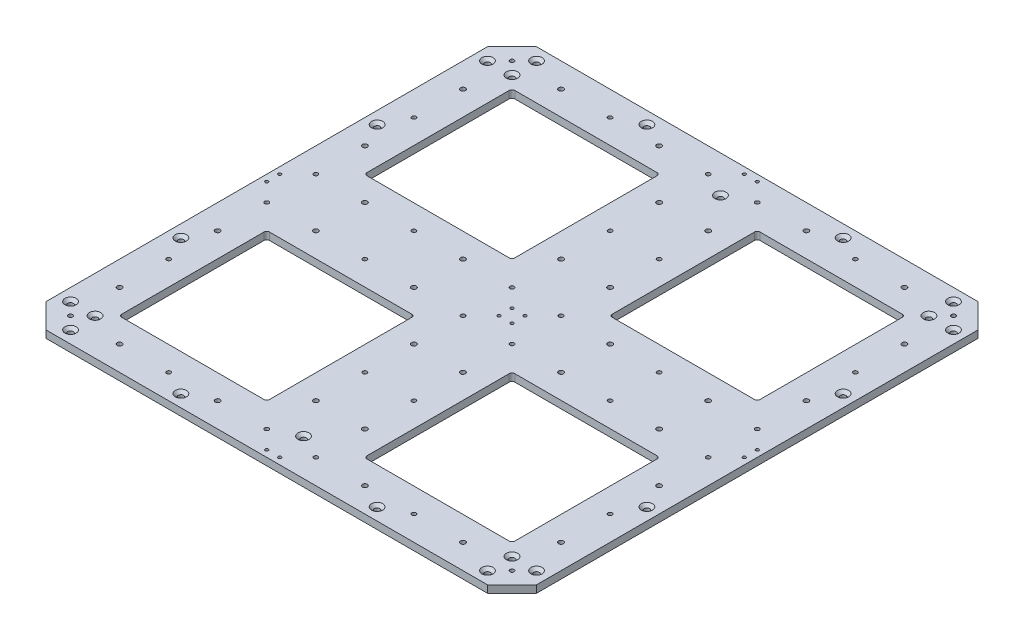
from build123d import *

# Parameters (mm, degrees)
SKETCH1_W                                            = 241
SKETCH1_H                                            = 241
BOSS_EXTRUDE1_DEPTH                                  = 12
M8_TAPPED_HOLE1_D                                    = 6.8
F_8_0MM_DOWEL_HOLE1_D                                = 8
LPATTERN1_COUNT                                      = 2
LPATTERN1_PITCH                                      = 400
LPATTERN1_COUNT_DIR2                                 = 2
LPATTERN1_PITCH_DIR2                                 = 400
CSK_FOR_M8_HEX_SOCKET_COUNTERSUNK_HEAD_S_D           = 9
CSK_FOR_M8_HEX_SOCKET_COUNTERSUNK_HEAD_S_CSINK_D     = 18.25
CSK_FOR_M8_HEX_SOCKET_COUNTERSUNK_HEAD_S_CSINK_ANGLE = 90
FILLET1_R                                            = 4.5
M6_TAPPED_HOLE1_D                                    = 5
CIRPATTERN1_COUNT                                    = 4


with BuildPart() as part:
    # Sketch1 → Boss-Extrude1 (new body)
    with BuildSketch(Plane(origin=(0, 0, 0), x_dir=(1, 0, 0), z_dir=(0, 1, 0))):
        Polygon((-400, 360), (-400, -360), (-360, -400), (360, -400), (400, -360), (400, 360), (360, 400), (-360, 400), align=None)
        with Locations((-200, -200)):
            Rectangle(SKETCH1_W, SKETCH1_H, mode=Mode.SUBTRACT)
        with Locations((200, 200)):
            Rectangle(SKETCH1_W, SKETCH1_H, mode=Mode.SUBTRACT)
        with Locations((200, -200)):
            Rectangle(SKETCH1_W, SKETCH1_H, mode=Mode.SUBTRACT)
        with Locations((-200, 200)):
            Rectangle(SKETCH1_W, SKETCH1_H, mode=Mode.SUBTRACT)
    extrude(amount=BOSS_EXTRUDE1_DEPTH)

    # M8 Tapped Hole1 (through all)
    with Locations(Plane(origin=(0, 12, 0), x_dir=(1, 0, 0), z_dir=(0, 1, 0))):
        with Locations((-360, 360), (360, 360), (-40, 360), (40, 360), (-40, 40), (40, 40), (360, 40), (-360, 40), (-360, -40), (-360, -360), (-40, -40), (-40, -360), (40, -360), (360, -360), (360, -40), (40, -40), (-200, 360), (200, 360), (360, 200), (200, 40), (40, 200), (-40, 200), (-200, 40), (-360, 200), (-200, -40), (-360, -200), (-200, -360), (-40, -200), (40, -200), (200, -40), (360, -200), (200, -360)):
            Hole(M8_TAPPED_HOLE1_D / 2)

    # Ø8.0mm Dowel Hole1 (through all)
    with Locations(Plane(origin=(0, 12, 0), x_dir=(1, 0, 0), z_dir=(0, 1, 0))):
        with Locations((-280, 360), (-120, 360), (-40, 280), (-40, 120), (-120, 40), (-280, 40), (-360, 120), (-360, 280)):
            f_8_0mm_dowel_hole1 = Hole(F_8_0MM_DOWEL_HOLE1_D / 2)

    # LPattern1: 8.0mm Dowel Hole1 2 × 2
    with Locations(*[(i * LPATTERN1_PITCH, 0, j * LPATTERN1_PITCH_DIR2) for i in range(LPATTERN1_COUNT) for j in range(LPATTERN1_COUNT_DIR2) if (i, j) != (0, 0)]):
        add(f_8_0mm_dowel_hole1, mode=Mode.SUBTRACT)

    # CSK for M8 Hex Socket Countersunk Head Screw1 (through all)
    with Locations(Plane(origin=(0, 12, 0), x_dir=(1, 0, 0), z_dir=(0, 1, 0))):
        with Locations((-380, 340), (-340, 380), (-380, -340), (380, -340), (380, 340), (-340, -380), (340, -380), (340, 380), (340, 340), (340, -340), (-340, -340), (0, -340), (0, 340), (-340, 340), (-160, 380), (160, 380), (380, 160), (380, -160), (160, -380), (-160, -380), (-380, -160), (-380, 160)):
            CounterSinkHole(CSK_FOR_M8_HEX_SOCKET_COUNTERSUNK_HEAD_S_D / 2, CSK_FOR_M8_HEX_SOCKET_COUNTERSUNK_HEAD_S_CSINK_D / 2, counter_sink_angle=CSK_FOR_M8_HEX_SOCKET_COUNTERSUNK_HEAD_S_CSINK_ANGLE)

    # Fillet1
    fillet1_edges = [part.edges().sort_by_distance(p)[0] for p in [
        (320.5, 6, -320.5),
        (-79.5, 6, 79.5),
        (320.5, 6, 79.5),
        (320.5, 6, -79.5),
        (320.5, 6, 320.5),
        (-79.5, 6, 320.5),
        (-320.5, 6, 79.5),
        (79.5, 6, 79.5),
        (79.5, 6, -320.5),
        (79.5, 6, -79.5),
        (79.5, 6, 320.5),
        (-320.5, 6, 320.5),
        (-320.5, 6, -79.5),
        (-79.5, 6, -79.5),
        (-79.5, 6, -320.5),
        (-320.5, 6, -320.5),
    ]]
    fillet(fillet1_edges, radius=FILLET1_R)

    # M6 Tapped Hole1 (through all)
    with Locations(Plane(origin=(0, 12, 0), x_dir=(1, 0, 0), z_dir=(0, 1, 0))):
        with Locations((-10.606601718, 10.606601718), (-10.606601718, -10.606601718), (-389.393398282, 10.606601718), (-389.393398282, -10.606601718)):
            m6_tapped_hole1 = Hole(M6_TAPPED_HOLE1_D / 2)

    # CirPattern1: M6 Tapped Hole1 ×4 about axis
    cirpattern1_axis = Axis((0, 12.6, 0), (0, -1, 0))
    for i in range(1, CIRPATTERN1_COUNT):
        add(m6_tapped_hole1.rotate(cirpattern1_axis, i * 360 / CIRPATTERN1_COUNT), mode=Mode.SUBTRACT)


solid = part.part
